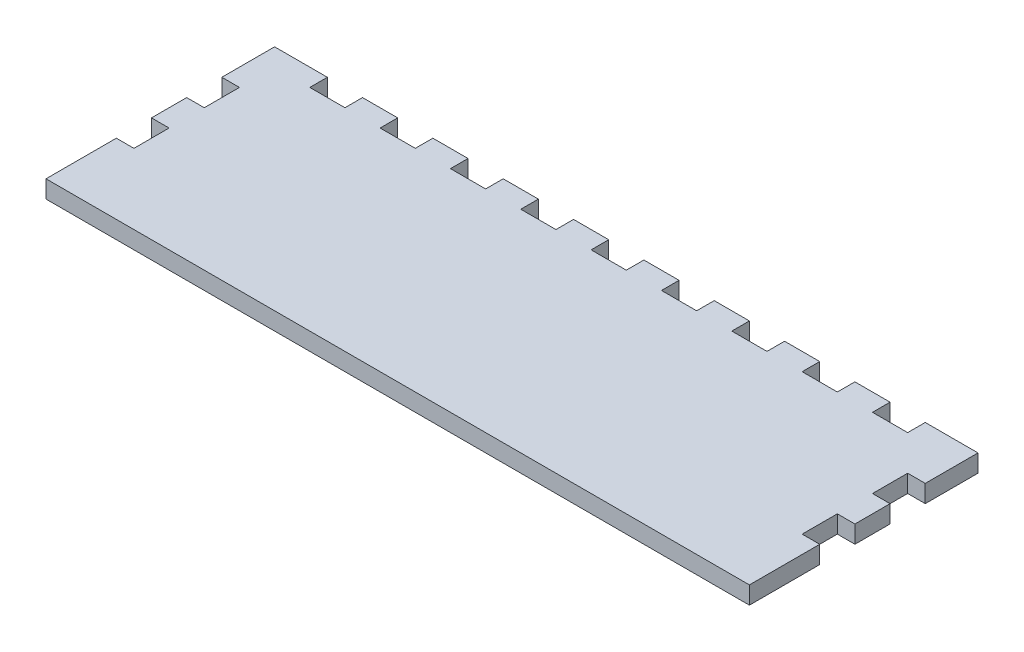
from build123d import *

# Parameters (mm, degrees)
SKETCH3_W           = 254
SKETCH3_H           = 82.55
BOSS_EXTRUDE2_DEPTH = 6.35
SKETCH4_W           = 6.35
SKETCH4_H           = 12.7
SKETCH4_W_2         = 12.7
SKETCH4_H_2         = 6.35
CUT_EXTRUDE2_DEPTH  = 6.35


with BuildPart() as part:
    # Sketch3 → Boss-Extrude2 (new body)
    with BuildSketch(Plane(origin=(0, 0, 0), x_dir=(-1, 0, 0), z_dir=(0, 1, 0))):
        with Locations((127, 41.275)):
            Rectangle(SKETCH3_W, SKETCH3_H)
    extrude(amount=BOSS_EXTRUDE2_DEPTH)

    # Sketch4 → Cut-Extrude2 (cut)
    with BuildSketch(Plane(origin=(0, 6.35, 0), x_dir=(-1, 0, 0), z_dir=(0, 1, 0))):
        with Locations((3.175, 25.4)):
            Rectangle(SKETCH4_W, SKETCH4_H)
        with Locations((3.175, 50.8)):
            Rectangle(SKETCH4_W, SKETCH4_H)
        with Locations((250.825, 25.4)):
            Rectangle(SKETCH4_W, SKETCH4_H)
        with Locations((250.825, 50.8)):
            Rectangle(SKETCH4_W, SKETCH4_H)
        with Locations((50.8, 3.175)):
            Rectangle(SKETCH4_W_2, SKETCH4_H_2)
        with Locations((25.4, 3.175)):
            Rectangle(SKETCH4_W_2, SKETCH4_H_2)
        with Locations((76.2, 3.175)):
            Rectangle(SKETCH4_W_2, SKETCH4_H_2)
        with Locations((101.6, 3.175)):
            Rectangle(SKETCH4_W_2, SKETCH4_H_2)
        with Locations((127, 3.175)):
            Rectangle(SKETCH4_W_2, SKETCH4_H_2)
        with Locations((177.8, 3.175)):
            Rectangle(SKETCH4_W_2, SKETCH4_H_2)
        with Locations((152.4, 3.175)):
            Rectangle(SKETCH4_W_2, SKETCH4_H_2)
        with Locations((203.2, 3.175)):
            Rectangle(SKETCH4_W_2, SKETCH4_H_2)
        with Locations((228.6, 3.175)):
            Rectangle(SKETCH4_W_2, SKETCH4_H_2)
    extrude(amount=-CUT_EXTRUDE2_DEPTH, mode=Mode.SUBTRACT)


solid = part.part
